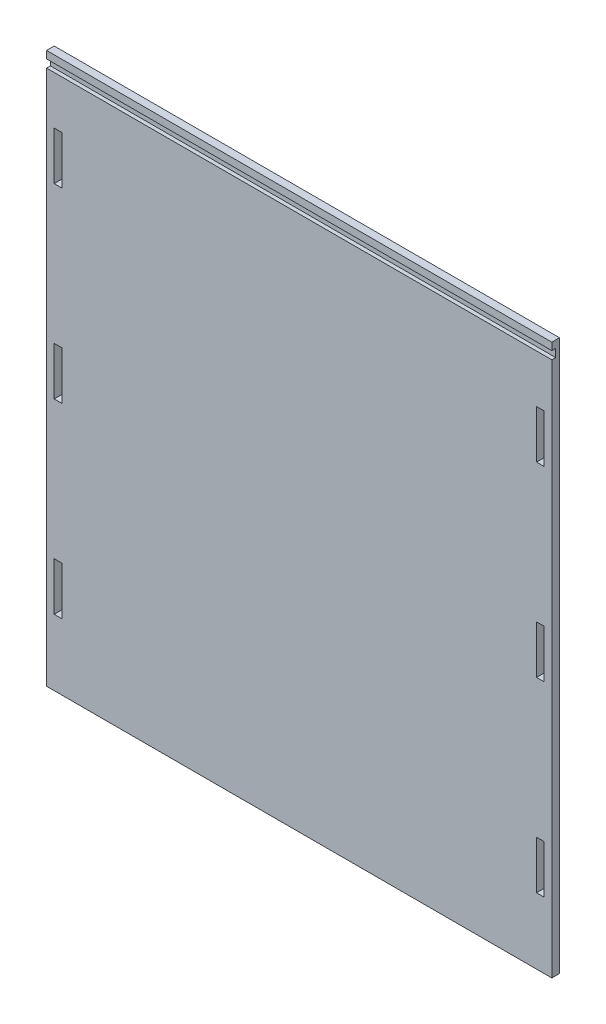
from build123d import *

# Parameters (mm, degrees)
SKETCH1_W           = 6.35
SKETCH1_H           = 40
BOSS_EXTRUDE1_DEPTH = 6.35
SKETCH2_W           = 3.175
SKETCH2_H           = 6.604
CUT_EXTRUDE1_DEPTH  = 622.232333753


with BuildPart() as part:
    # Sketch1 → Boss-Extrude1 (new body)
    with BuildSketch(Plane.XY):
        Polygon((0, 0), (420, 0), (420, 457.7), (413.65, 457.7), (407.3, 457.7), (12.7, 457.7), (6.35, 457.7), (0, 457.7), align=None)
        with Locations((9.525, 385)):
            Rectangle(SKETCH1_W, SKETCH1_H, mode=Mode.SUBTRACT)
        with Locations((410.475, 385)):
            Rectangle(SKETCH1_W, SKETCH1_H, mode=Mode.SUBTRACT)
        with Locations((9.525, 230)):
            Rectangle(SKETCH1_W, SKETCH1_H, mode=Mode.SUBTRACT)
        with Locations((410.475, 230)):
            Rectangle(SKETCH1_W, SKETCH1_H, mode=Mode.SUBTRACT)
        with Locations((410.475, 75)):
            Rectangle(SKETCH1_W, SKETCH1_H, mode=Mode.SUBTRACT)
        with Locations((9.525, 75)):
            Rectangle(SKETCH1_W, SKETCH1_H, mode=Mode.SUBTRACT)
    extrude(amount=BOSS_EXTRUDE1_DEPTH)

    # Sketch2 → Cut-Extrude1 (cut, through all)
    with BuildSketch(Plane(origin=(420, 0, 0), x_dir=(0, 0, -1), z_dir=(1, 0, 0))):
        with Locations((-4.7625, 448.302)):
            Rectangle(SKETCH2_W, SKETCH2_H)
    extrude(amount=-CUT_EXTRUDE1_DEPTH, mode=Mode.SUBTRACT)


solid = part.part
